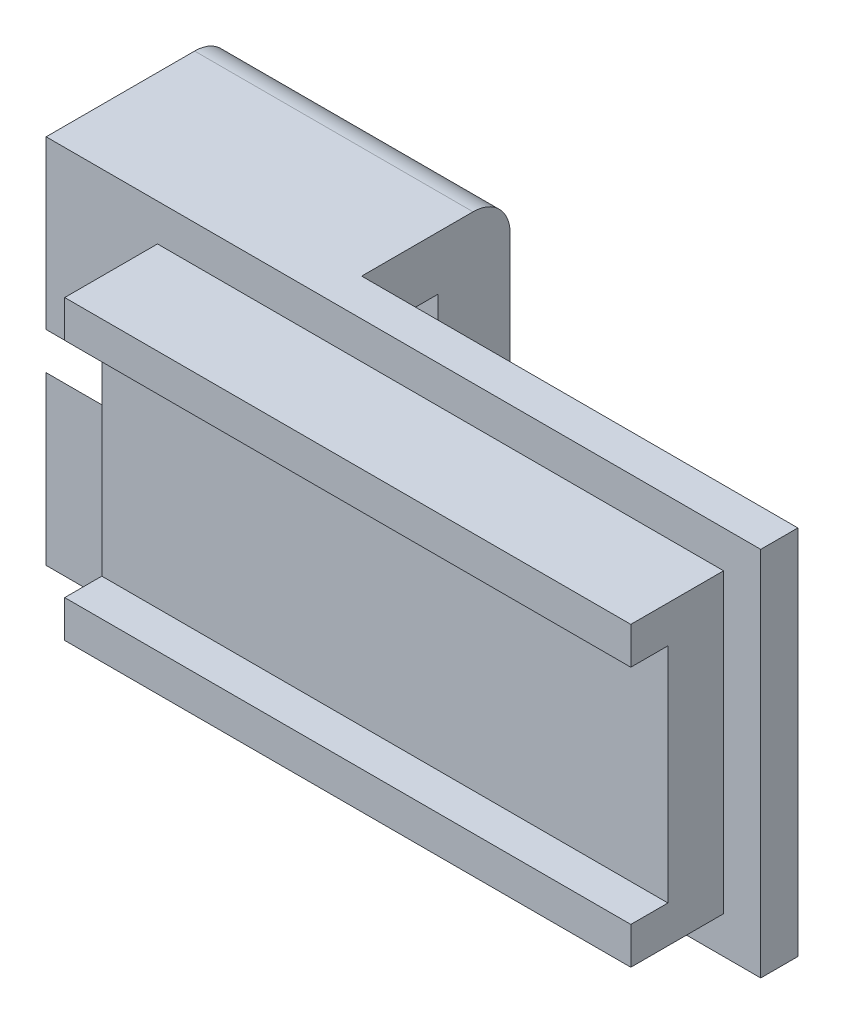
from build123d import *

# Parameters (mm, degrees)
SKETCH1_W           = 20
SKETCH1_H           = 10
BOSS_EXTRUDE1_DEPTH = 38.5
SKETCH5_W           = 16
SKETCH5_H           = 30.5
BOSS_EXTRUDE2_DEPTH = 8
SKETCH2_R           = 5.1
CUT_EXTRUDE3_DEPTH  = 10
FILLET1_R           = 2
SKETCH6_W           = 23.5
SKETCH6_H           = 20
CUT_EXTRUDE4_DEPTH  = 8
SKETCH7_W           = 2.2
SKETCH7_H           = 2.2
CUT_EXTRUDE5_DEPTH  = 3
SKETCH8_W           = 30.5
SKETCH8_H           = 2
BOSS_EXTRUDE3_DEPTH = 2


with BuildPart() as part:
    # Sketch1 → Boss-Extrude1 (new body)
    with BuildSketch(Plane.YZ):
        Rectangle(SKETCH1_W, SKETCH1_H)
    extrude(amount=BOSS_EXTRUDE1_DEPTH)

    # Sketch5 → Boss-Extrude2 (add)
    with BuildSketch(Plane(origin=(0, 0, 0), x_dir=(0, 1, 0), z_dir=(0, 0, 1))):
        with Locations((0, -21.25)):
            Rectangle(SKETCH5_W, SKETCH5_H)
    extrude(amount=BOSS_EXTRUDE2_DEPTH)

    # Sketch2 → Cut-Extrude3 (cut)
    with BuildSketch(Plane.YZ):
        Circle(SKETCH2_R)
    extrude(amount=CUT_EXTRUDE3_DEPTH, mode=Mode.SUBTRACT)

    # Fillet1
    fillet1_edges = [part.edges().sort_by_distance(p)[0] for p in [
        (19.25, 10, -5),
        (19.25, -10, -5),
    ]]
    fillet(fillet1_edges, radius=FILLET1_R)

    # Sketch6 → Cut-Extrude4 (cut)
    with BuildSketch(Plane(origin=(0, 0, -5), x_dir=(1, 0, 0), z_dir=(0, 0, -1))):
        with Locations((26.75, 0)):
            Rectangle(SKETCH6_W, SKETCH6_H)
    extrude(amount=-CUT_EXTRUDE4_DEPTH, mode=Mode.SUBTRACT)

    # Sketch7 → Cut-Extrude5 (cut)
    with BuildSketch(Plane.YZ.offset(15)):
        with Locations((6, 0)):
            Rectangle(SKETCH7_W, SKETCH7_H)
        with Locations((-6, 0)):
            Rectangle(SKETCH7_W, SKETCH7_H)
    extrude(amount=-CUT_EXTRUDE5_DEPTH, mode=Mode.SUBTRACT)

    # Sketch8 → Boss-Extrude3 (add)
    with BuildSketch(Plane.XY.offset(8)):
        with Locations((21.25, 7)):
            Rectangle(SKETCH8_W, SKETCH8_H)
        with Locations((21.25, -7)):
            Rectangle(SKETCH8_W, SKETCH8_H)
    extrude(amount=BOSS_EXTRUDE3_DEPTH)


solid = part.part
